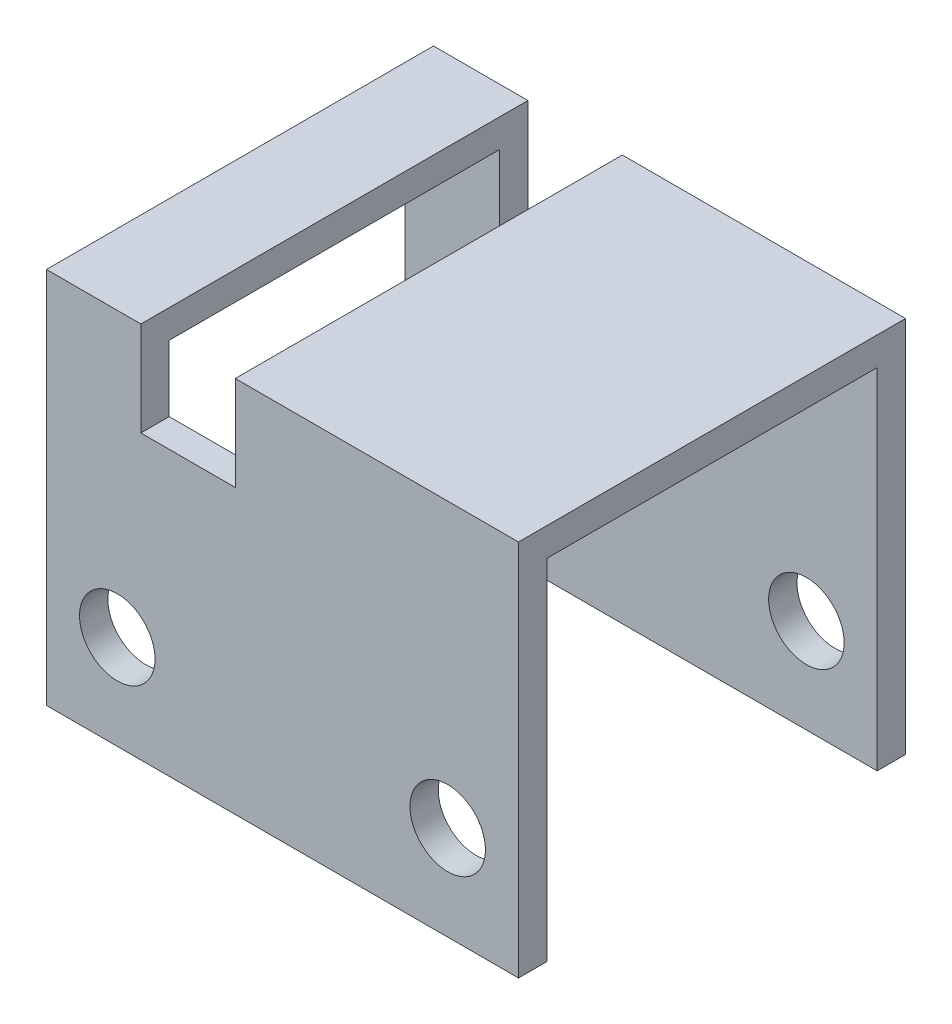
from build123d import *

# Parameters (mm, degrees)
EXTRUDE_1_DEPTH     = 41
SKETCH_2_W          = 35
SKETCH_2_H          = 37
CUT_EXTRUDE_1_DEPTH = 75.498322129
SKETCH_3_R          = 4
CUT_EXTRUDE_2_DEPTH = 61.621778265


with BuildPart() as part:
    # ｽｹｯﾁ1 → ﾎﾞｽ - 押し出し1 (new body)
    with BuildSketch(Plane.XY):
        Polygon((-25, -37), (25, -37), (25, 3), (-5, 3), (-5, -7), (-15, -7), (-15, 3), (-25, 3), align=None)
    extrude(amount=EXTRUDE_1_DEPTH)

    # ｽｹｯﾁ2 → ｶｯﾄ - 押し出し1 (cut, through all)
    with BuildSketch(Plane(origin=(25, 0, 0), x_dir=(0, 0, -1), z_dir=(1, 0, 0))):
        with Locations((-20.5, -18.5)):
            Rectangle(SKETCH_2_W, SKETCH_2_H)
    extrude(amount=-CUT_EXTRUDE_1_DEPTH, mode=Mode.SUBTRACT)

    # ｽｹｯﾁ3 → ｶｯﾄ - 押し出し2 (cut, through all)
    with BuildSketch(Plane.XY.offset(41)):
        with Locations((-17.5, -27)):
            Circle(SKETCH_3_R)
        with Locations((17.5, -27)):
            Circle(SKETCH_3_R)
    extrude(amount=-CUT_EXTRUDE_2_DEPTH, mode=Mode.SUBTRACT)


solid = part.part
